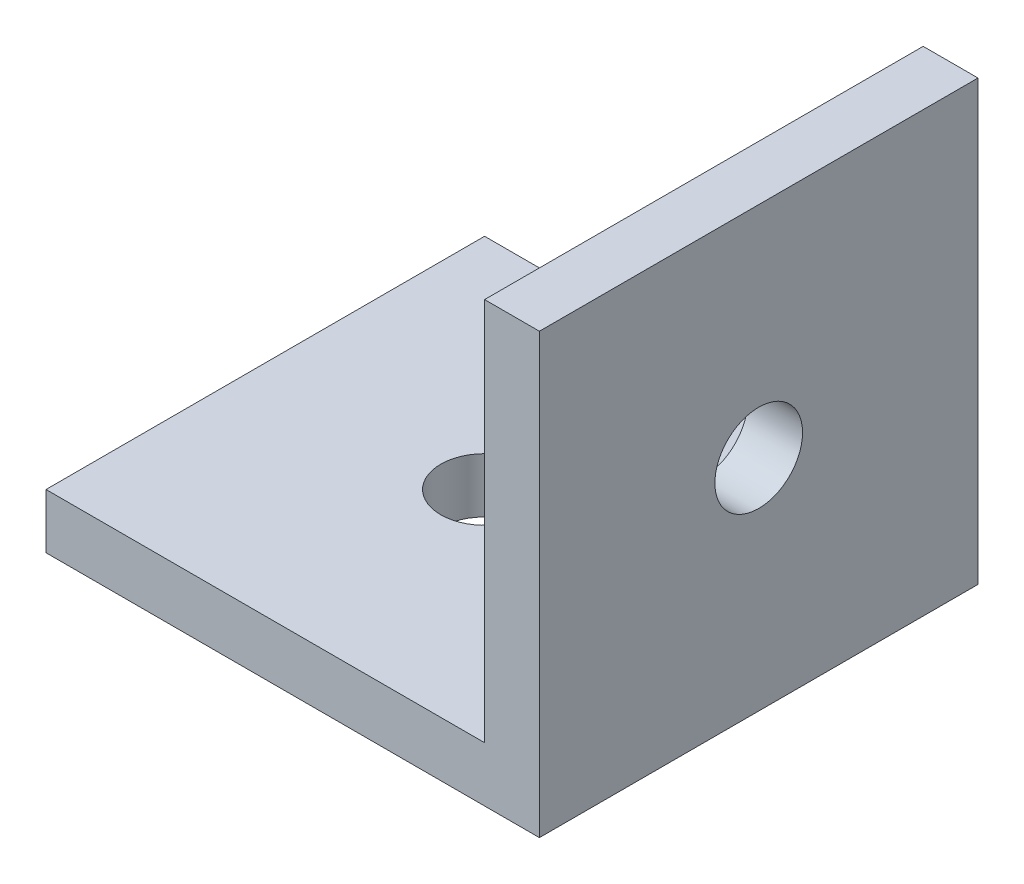
from build123d import *

# Parameters (mm, degrees)
SKETCH1_W           = 40
SKETCH1_H           = 40
SKETCH1_R           = 4
BOSS_EXTRUDE1_DEPTH = 5
SKETCH2_W           = 40
SKETCH2_H           = 40
SKETCH2_R           = 4
BOSS_EXTRUDE2_DEPTH = 5


with BuildPart() as part:
    # Sketch1 → Boss-Extrude1 (new body)
    with BuildSketch(Plane(origin=(0, 0, 0), x_dir=(1, 0, 0), z_dir=(0, 1, 0))):
        Rectangle(SKETCH1_W, SKETCH1_H)
        with Locations(Location((0, 0, 0), (0, 0, 270))):
            Circle(SKETCH1_R, mode=Mode.SUBTRACT)
    extrude(amount=BOSS_EXTRUDE1_DEPTH)

    # Sketch2 → Boss-Extrude2 (add)
    with BuildSketch(Plane(origin=(20, 0, 0), x_dir=(0, 0, -1), z_dir=(1, 0, 0))):
        with Locations((0, 20)):
            Rectangle(SKETCH2_W, SKETCH2_H)
        with Locations((0, 20)):
            Circle(SKETCH2_R, mode=Mode.SUBTRACT)
    extrude(amount=BOSS_EXTRUDE2_DEPTH)


solid = part.part
